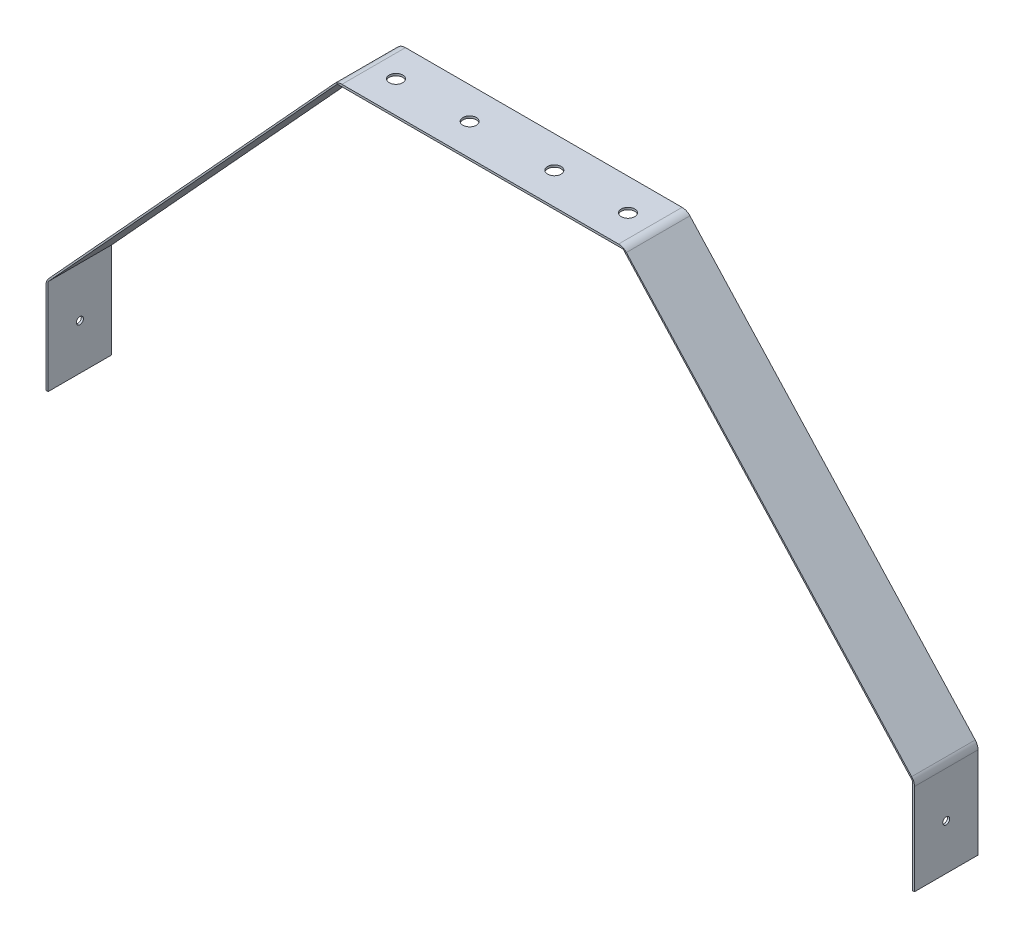
from build123d import *

# Parameters (mm, degrees)
SKETCH1_W           = 410
SKETCH1_H           = 195
BOSS_EXTRUDE1_DEPTH = 30
CUT_EXTRUDE1_DEPTH  = 30
CUT_EXTRUDE2_DEPTH  = 30
FILLET1_R           = 5
FILLET4_R           = 5
FILLET5_R           = 5
FILLET6_R           = 5
SKETCH4_R           = 1.65
CUT_EXTRUDE3_DEPTH  = 423.5
SKETCH5_R           = 3.175
CUT_EXTRUDE4_DEPTH  = 10


with BuildPart() as part:
    # Sketch1 → Boss-Extrude1 (new body)
    with BuildSketch(Plane.XY):
        Rectangle(SKETCH1_W, SKETCH1_H)
    extrude(amount=BOSS_EXTRUDE1_DEPTH)

    # Sketch2 → Cut-Extrude1 (cut)
    with BuildSketch(Plane.XY.offset(30)):
        Polygon((-205, 97.5), (-205, -52.5), (-67.5, 97.5), align=None)
        Polygon((205, 97.5), (67.5, 97.5), (205, -52.5), align=None)
    extrude(amount=-CUT_EXTRUDE1_DEPTH, mode=Mode.SUBTRACT)

    # Sketch3 → Cut-Extrude2 (cut)
    with BuildSketch(Plane.XY.offset(30)):
        Polygon((-67.5, 96.5), (-204, -52.5), (-204, -97.5), (204, -97.5), (204, -52.5), (67.5, 96.5), align=None)
    extrude(amount=-CUT_EXTRUDE2_DEPTH, mode=Mode.SUBTRACT)

    # Fillet1
    fillet1_edges = [part.edges().sort_by_distance(p)[0] for p in [
        (-205, -52.5, 15),
    ]]
    fillet(fillet1_edges, radius=FILLET1_R)

    # Fillet4
    fillet4_edges = [part.edges().sort_by_distance(p)[0] for p in [
        (-67.5, 97.5, 15),
    ]]
    fillet(fillet4_edges, radius=FILLET4_R)

    # Fillet5
    fillet5_edges = [part.edges().sort_by_distance(p)[0] for p in [
        (67.5, 97.5, 15),
    ]]
    fillet(fillet5_edges, radius=FILLET5_R)

    # Fillet6
    fillet6_edges = [part.edges().sort_by_distance(p)[0] for p in [
        (205, -52.5, 15),
    ]]
    fillet(fillet6_edges, radius=FILLET6_R)

    # Sketch4 → Cut-Extrude3 (cut, through all)
    with BuildSketch(Plane(origin=(205, 0, 0), x_dir=(0, 0, -1), z_dir=(1, 0, 0))):
        with Locations(Location((-15, -75.972459226, 0), (0, 0, 90))):
            Circle(SKETCH4_R)
    extrude(amount=-CUT_EXTRUDE3_DEPTH, mode=Mode.SUBTRACT)

    # Sketch5 → Cut-Extrude4 (cut)
    with BuildSketch(Plane(origin=(0, 97.5, 0), x_dir=(1, 0, 0), z_dir=(0, 1, 0))):
        with Locations(Location((-20, -15, 0), (0, 0, 270))):
            Circle(SKETCH5_R)
        with Locations(Location((20, -15, 0), (0, 0, 270))):
            Circle(SKETCH5_R)
        with Locations(Location((54.768750122, -15, 0), (0, 0, 270))):
            Circle(SKETCH5_R)
        with Locations(Location((-54.768749878, -15, 0), (0, 0, 270))):
            Circle(SKETCH5_R)
    extrude(amount=-CUT_EXTRUDE4_DEPTH, mode=Mode.SUBTRACT)


solid = part.part
